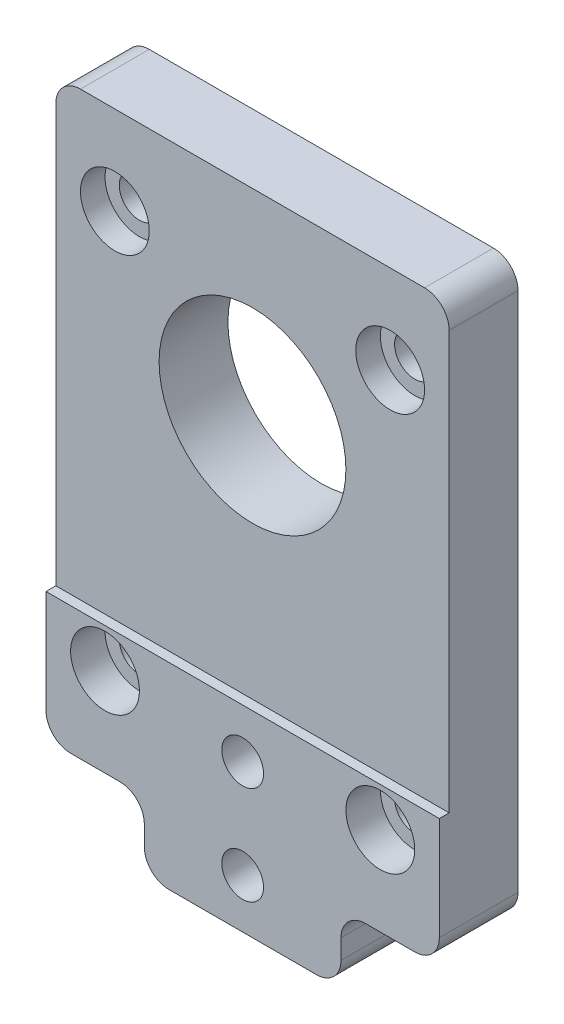
from build123d import *
from build123d.topology import SkipClean

# Parameters (mm, degrees)
SKETCH1_R           = 2.125
BOSS_EXTRUDE2_DEPTH = 8
SKETCH7_W           = 40
SKETCH7_H           = 58
BOSS_EXTRUDE3_DEPTH = 8
FILLET1_R           = 2.5
SKETCH3_R           = 9.5
CUT_EXTRUDE2_DEPTH  = 55.442630355
SKETCH2_R           = 2.05
CUT_EXTRUDE1_DEPTH  = 55.442630355
SKETCH6_W           = 60
SKETCH6_H           = 50
CUT_EXTRUDE5_DEPTH  = 1
SKETCH9_R           = 2.125
CUT_EXTRUDE7_DEPTH  = 55.442630355
SKETCH11_R          = 3.5
CUT_EXTRUDE9_DEPTH  = 3.5


with BuildPart() as part:
    # Sketch1 → Boss-Extrude2 (new body)
    with BuildSketch(Plane.XY):
        with BuildLine():
            Line((-10, -15), (-10, 15))
            Line((-10, 15), (-15, 30))
            ThreePointArc((-15, 30), (0, 45), (15, 30))
            Line((15, 30), (10, 15))
            Line((10, 15), (10, -15))
            Line((10, -15), (-10, -15))
        make_face()
        Circle(SKETCH1_R, mode=Mode.SUBTRACT)
        with Locations((0, -10)):
            Circle(SKETCH1_R, mode=Mode.SUBTRACT)
    extrude(amount=BOSS_EXTRUDE2_DEPTH)

    # Sketch7 → Boss-Extrude3 (add)
    with BuildSketch(Plane(origin=(0, 0, 0), x_dir=(-1, 0, 0), z_dir=(0, 0, -1))):
        with Locations((0, 21)):
            Rectangle(SKETCH7_W, SKETCH7_H)
    extrude(amount=-BOSS_EXTRUDE3_DEPTH)

    # Fillet1
    fillet1_edges = [part.edges().sort_by_distance(p)[0] for p in [
        (10, -15, 4),
        (-10, -15, 4),
        (-20, -8, 4),
        (-10, -8, 4),
        (10, -8, 4),
        (-20, 50, 4),
        (20, 50, 4),
        (20, -8, 4),
    ]]
    fillet(fillet1_edges, radius=FILLET1_R)

    # Sketch3 → Cut-Extrude2 (cut, through all)
    with BuildSketch(Plane.XY.offset(8)):
        with Locations((0, 30)):
            Circle(SKETCH3_R)
    extrude(amount=-CUT_EXTRUDE2_DEPTH, mode=Mode.SUBTRACT)

    # Sketch2 → Cut-Extrude1 (cut, through all)
    with BuildSketch(Plane.XY.offset(8)):
        with Locations((-14, 41)):
            Circle(SKETCH2_R)
        with Locations((14, 41)):
            Circle(SKETCH2_R)
        with Locations((14, 1)):
            Circle(SKETCH2_R)
        with Locations((-14, 1)):
            Circle(SKETCH2_R)
    extrude(amount=-CUT_EXTRUDE1_DEPTH, mode=Mode.SUBTRACT)

    # Sketch6 → Cut-Extrude5 (cut)
    with BuildSketch(Plane.XY.offset(8)):
        with Locations((0, 30)):
            Rectangle(SKETCH6_W, SKETCH6_H)
    extrude(amount=-CUT_EXTRUDE5_DEPTH, mode=Mode.SUBTRACT)

    # Sketch9 → Cut-Extrude7 (cut, through all)
    with SkipClean():  # the faces are left unmerged after this step: merging them gives an invalid solid
        with BuildSketch(Plane.XY.offset(8)):
            with Locations((0, -10)):
                Circle(SKETCH9_R)
            Circle(SKETCH9_R)
        extrude(amount=-CUT_EXTRUDE7_DEPTH, mode=Mode.SUBTRACT)

    # Sketch11 → Cut-Extrude9 (cut)
    with SkipClean():  # the faces are left unmerged after this step: merging them gives an invalid solid
        with BuildSketch(Plane.XY.offset(8)):
            with Locations((-14, 1)):
                Circle(SKETCH11_R)
            with Locations((14, 1)):
                Circle(SKETCH11_R)
            with Locations((14, 41)):
                Circle(SKETCH11_R)
            with Locations((-14, 41)):
                Circle(SKETCH11_R)
        extrude(amount=-CUT_EXTRUDE9_DEPTH, mode=Mode.SUBTRACT)


solid = part.part
